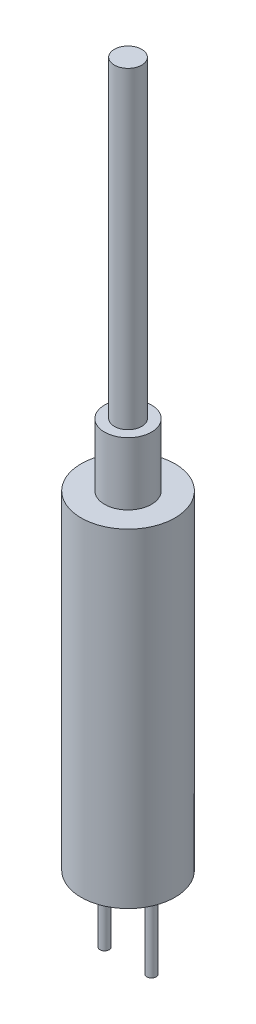
from build123d import *

# Parameters (mm, degrees)
SK_ELECTRODE_PINS_R    = 0.6
ELECTRODE_PINS_DEPTH   = 10
ELECTRODE_PINS_2_DEPTH = 10
PROBE_START            = 10
SK_PROBE_BODY_R        = 6
PROBE_BODY_DEPTH       = 42
STRAIN_START           = 52
SK_STRAIN_RELIEF_R     = 3
STRAIN_RELIEF_DEPTH    = 8
CABLE_START            = 60
SK_CABLE_R             = 1.75
CABLE_DEPTH            = 40


with BuildPart() as part:
    # SK Electrode pins → Electrode pins (new body)
    with BuildSketch(Plane(origin=(0, 0, 0), x_dir=(1, 0, 0), z_dir=(0, 1, 0))):
        with Locations(Location((-3, 0, 0), (0, 0, 270))):
            Circle(SK_ELECTRODE_PINS_R)
    extrude(amount=ELECTRODE_PINS_DEPTH)


with BuildPart() as body_2:
    # SK Electrode pins → Electrode pins 2 (new body)
    with BuildSketch(Plane(origin=(0, 0, 0), x_dir=(1, 0, 0), z_dir=(0, 1, 0))):
        with Locations(Location((3, 0, 0), (0, 0, 270))):
            Circle(SK_ELECTRODE_PINS_R)
    extrude(amount=ELECTRODE_PINS_2_DEPTH)


with BuildPart() as body_3:
    # SK Probe body → Probe body (new body)
    with BuildSketch(Plane(origin=(0, 0, 0), x_dir=(1, 0, 0), z_dir=(0, 1, 0)).offset(PROBE_START)):
        with Locations(Location((0, 0, 0), (0, 0, 90))):
            Circle(SK_PROBE_BODY_R)
    extrude(amount=PROBE_BODY_DEPTH)


with BuildPart() as body_4:
    # SK Strain relief → Strain relief (new body)
    with BuildSketch(Plane(origin=(0, 0, 0), x_dir=(1, 0, 0), z_dir=(0, 1, 0)).offset(STRAIN_START)):
        with Locations(Location((0, 0, 0), (0, 0, 270))):
            Circle(SK_STRAIN_RELIEF_R)
    extrude(amount=STRAIN_RELIEF_DEPTH)


with BuildPart() as body_5:
    # SK Cable → Cable (new body)
    with BuildSketch(Plane(origin=(0, 0, 0), x_dir=(1, 0, 0), z_dir=(0, 1, 0)).offset(CABLE_START)):
        with Locations(Location((0, 0, 0), (0, 0, 270))):
            Circle(SK_CABLE_R)
    extrude(amount=CABLE_DEPTH)


solid = Compound([part.part, body_2.part, body_3.part, body_4.part, body_5.part])
